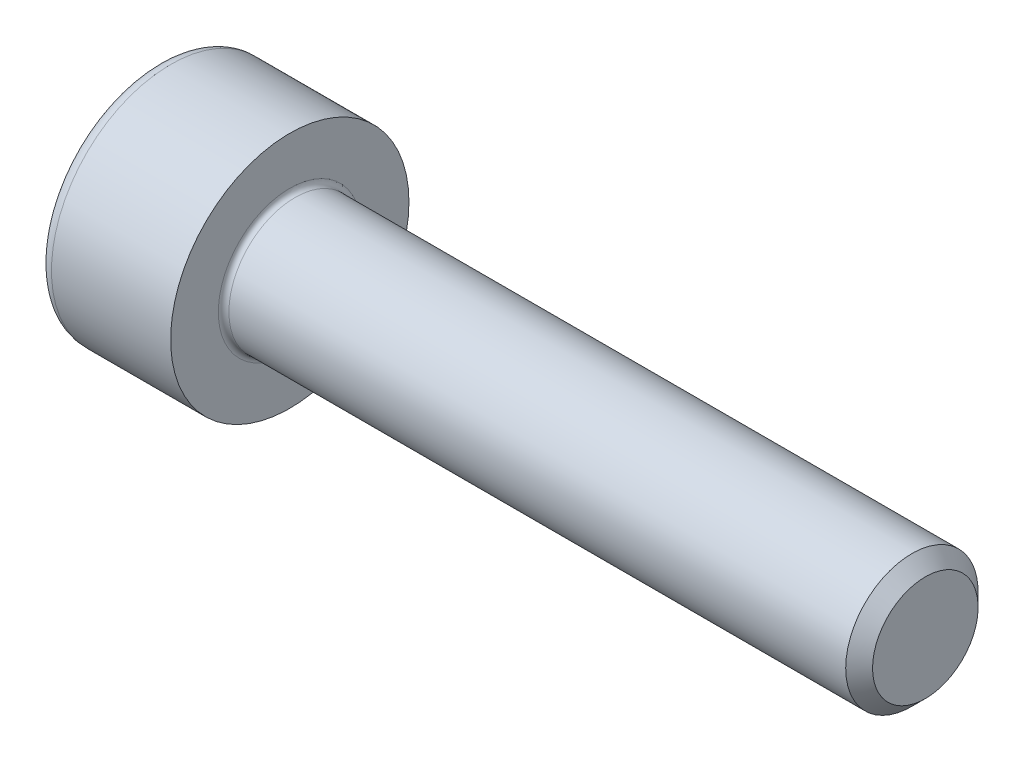
from build123d import *

# Parameters (mm, degrees)
BASEHEADSKE_R   = 2.25
BASEHEAD_DEPTH  = 2.5
CUTSOCKET_DEPTH = 1.1
FILLET1_R       = 0.1
FILLET2_R       = 0.25


with BuildPart() as part:
    # BaseHeadSke → BaseHead (new body)
    with BuildSketch(Plane(origin=(0, 0, 0), x_dir=(0, 0, -1), z_dir=(1, 0, 0))):
        Circle(BASEHEADSKE_R)
    extrude(amount=BASEHEAD_DEPTH)

    # BodySke → BaseBody (revolve)
    with BuildSketch(Plane.XY, mode=Mode.PRIVATE) as basebody_sk:
        Polygon((0, 0), (14.5, 0), (14.5, 0.9965), (14.2465, 1.25), (0, 1.25), align=None)
    revolve(basebody_sk.sketch.rotate(Axis((0, 0, 0), (1, 0, 0)), 90), axis=Axis((0, 0, 0), (1, 0, 0)))

    # CutSocketSke → CutSocket (cut)
    with BuildSketch(Plane(origin=(0, 0, 0), x_dir=(0, 0, -1), z_dir=(1, 0, 0))):
        Polygon((0, 1.154700538), (-1, 0.577350269), (-1, -0.577350269), (0, -1.154700538), (1, -0.577350269), (1, 0.577350269), align=None)
    extrude(amount=CUTSOCKET_DEPTH, mode=Mode.SUBTRACT)

    # CutHoleSke → CutHole (revolve, cut)
    with BuildSketch(Plane.XY, mode=Mode.PRIVATE) as cuthole_sk:
        Polygon((0, 1), (1.65, 1), (2.227350269, 0), (0, 0), align=None)
    revolve(cuthole_sk.sketch.rotate(Axis((0, 0, 0), (1, 0, 0)), 90), axis=Axis((0, 0, 0), (1, 0, 0)), mode=Mode.SUBTRACT)

    # Fillet1
    fillet1_edges = [part.edges().sort_by_distance(p)[0] for p in [
        (2.5, 0, -1.25),
    ]]
    fillet(fillet1_edges, radius=FILLET1_R)

    # Fillet2
    fillet2_edges = [part.edges().sort_by_distance(p)[0] for p in [
        (0, 0, 2.25),
    ]]
    fillet(fillet2_edges, radius=FILLET2_R)


solid = part.part
